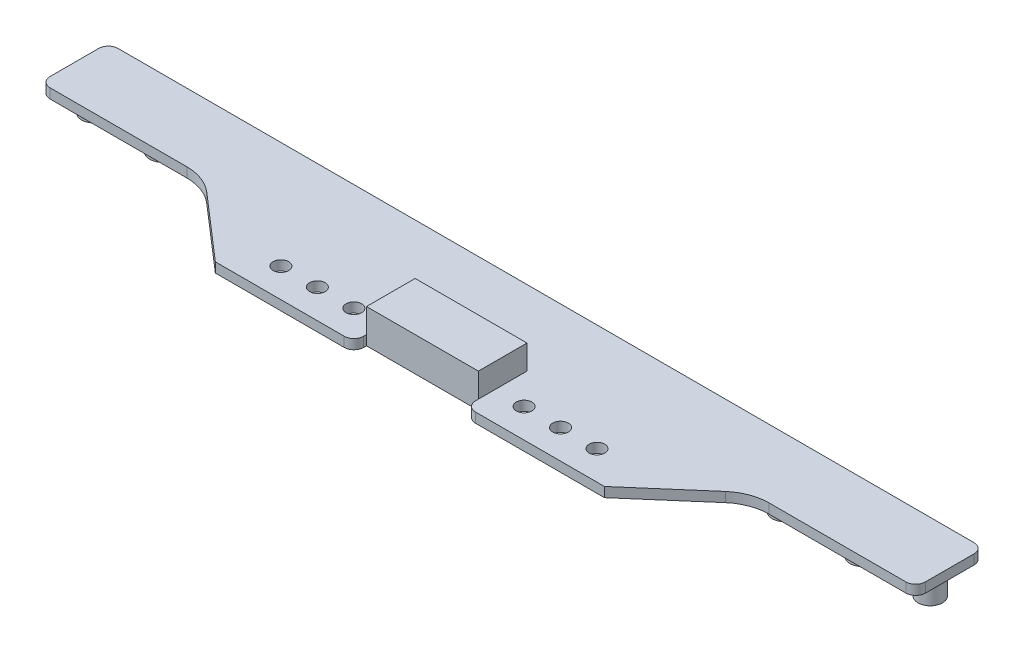
from build123d import *

# Parameters (mm, degrees)
SKETCH_1_R      = 1.6
EXTRUDE_1_DEPTH = 2
FILLET_1_R      = 2
FILLET_2_R      = 10
SKETCH_2_R      = 2.5
EXTRUDE_2_DEPTH = 5
SKETCH_3_W      = 23
SKETCH_3_H      = 10
EXTRUDE_4_DEPTH = 5


with BuildPart() as part:
    # 草图1 → 凸台-拉伸1 (new body)
    with BuildSketch(Plane(origin=(0, 0, 0), x_dir=(1, 0, 0), z_dir=(0, 1, 0))):
        Polygon((-11.5, 4.501120792), (11.5, 4.501120792), (11.5, 1.918654762), (40, 1.918654762), (56.146384284, 15.918654762), (90, 15.918654762), (90, 29.918654762), (-90, 29.918654762), (-90, 15.918654762), (-56.146384284, 15.918654762), (-40, 1.918654762), (-11.5, 1.918654762), align=None)
        with Locations(Location((17.5, 7.896444982, 0), (0, 0, 270))):
            Circle(SKETCH_1_R, mode=Mode.SUBTRACT)
        with Locations(Location((25, 7.896444982, 0), (0, 0, 270))):
            Circle(SKETCH_1_R, mode=Mode.SUBTRACT)
        with Locations(Location((32.5, 7.896444982, 0), (0, 0, 270))):
            Circle(SKETCH_1_R, mode=Mode.SUBTRACT)
        with Locations(Location((-32.5, 7.896444982, 0), (0, 0, 90))):
            Circle(SKETCH_1_R, mode=Mode.SUBTRACT)
        with Locations(Location((-25, 7.896444982, 0), (0, 0, 90))):
            Circle(SKETCH_1_R, mode=Mode.SUBTRACT)
        with Locations(Location((-17.5, 7.896444982, 0), (0, 0, 90))):
            Circle(SKETCH_1_R, mode=Mode.SUBTRACT)
    extrude(amount=EXTRUDE_1_DEPTH)

    # 圆角1
    fillet_1_edges = [part.edges().sort_by_distance(p)[0] for p in [
        (-11.5, 1, -1.918654762),
        (-90, 1, -15.918654762),
        (-90, 1, -29.918654762),
        (90, 1, -29.918654762),
        (90, 1, -15.918654762),
        (11.5, 1, -1.918654762),
    ]]
    fillet(fillet_1_edges, radius=FILLET_1_R)

    # 圆角2
    fillet_2_edges = [part.edges().sort_by_distance(p)[0] for p in [
        (-56.146384284, 1, -15.918654762),
        (56.146384284, 1, -15.918654762),
    ]]
    fillet(fillet_2_edges, radius=FILLET_2_R)

    # 草图2 → 凸台-拉伸2 (add)
    with BuildSketch(Plane.XZ):
        with Locations(Location((-8, -22.918654762, 0), (0, 0, 90))):
            Circle(SKETCH_2_R)
        with Locations(Location((-24, -22.918654762, 0), (0, 0, 90))):
            Circle(SKETCH_2_R)
        with Locations(Location((-40, -22.918654762, 0), (0, 0, 90))):
            Circle(SKETCH_2_R)
        with Locations(Location((-56, -22.918654762, 0), (0, 0, 90))):
            Circle(SKETCH_2_R)
        with Locations(Location((-72, -22.918654762, 0), (0, 0, 90))):
            Circle(SKETCH_2_R)
        with Locations(Location((-86, -22.918654762, 0), (0, 0, 90))):
            Circle(SKETCH_2_R)
        with Locations(Location((8, -22.918654762, 0), (0, 0, 90))):
            Circle(SKETCH_2_R)
        with Locations(Location((24, -22.918654762, 0), (0, 0, 90))):
            Circle(SKETCH_2_R)
        with Locations(Location((40, -22.918654762, 0), (0, 0, 90))):
            Circle(SKETCH_2_R)
        with Locations(Location((56, -22.918654762, 0), (0, 0, 90))):
            Circle(SKETCH_2_R)
        with Locations(Location((72, -22.918654762, 0), (0, 0, 90))):
            Circle(SKETCH_2_R)
        with Locations(Location((86, -22.918654762, 0), (0, 0, 90))):
            Circle(SKETCH_2_R)
    extrude(amount=EXTRUDE_2_DEPTH)

    # 草图3 → 凸台-拉伸4 (add)
    with BuildSketch(Plane(origin=(0, 2, 0), x_dir=(1, 0, 0), z_dir=(0, 1, 0))):
        with Locations((0, 9.501120792)):
            Rectangle(SKETCH_3_W, SKETCH_3_H)
    extrude(amount=EXTRUDE_4_DEPTH)


solid = part.part
